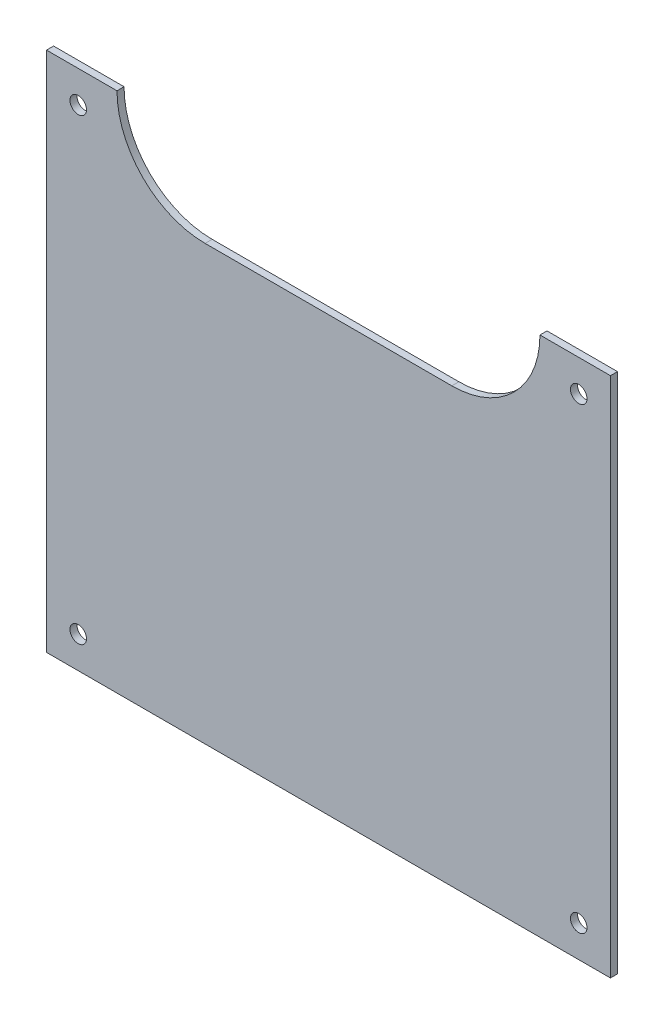
from build123d import *

# Parameters (mm, degrees)
AUFSATZ_LINEAR_AUSTRAGEN1_DEPTH = 2
SKIZZE3_R                       = 2.35
SCHNITT_LINEAR_AUSTRAGEN1_DEPTH = 109.995412748


with BuildPart() as part:
    # Skizze1 → Aufsatz-Linear austragen1 (new body)
    with BuildSketch(Plane.XY):
        with BuildLine():
            Line((-35, 49), (35, 49))
            ThreePointArc((35, 49), (52.67766953, 56.32233047), (60, 74))
            Line((60, 74), (80, 74))
            Line((80, 74), (80, -74))
            Line((80, -74), (-80, -74))
            Line((-80, -74), (-80, 74))
            Line((-80, 74), (-60, 74))
            ThreePointArc((-60, 74), (-52.67766953, 56.32233047), (-35, 49))
        make_face()
    extrude(amount=AUFSATZ_LINEAR_AUSTRAGEN1_DEPTH)

    # Skizze3 → Schnitt-Linear austragen1 (cut, through all)
    with BuildSketch(Plane.XY.offset(2)):
        with Locations((71, 65)):
            Circle(SKIZZE3_R)
        with Locations((-71, -65)):
            Circle(SKIZZE3_R)
        with Locations((71, -65)):
            Circle(SKIZZE3_R)
        with Locations((-71, 65)):
            Circle(SKIZZE3_R)
    extrude(amount=-SCHNITT_LINEAR_AUSTRAGEN1_DEPTH, mode=Mode.SUBTRACT)


solid = part.part
